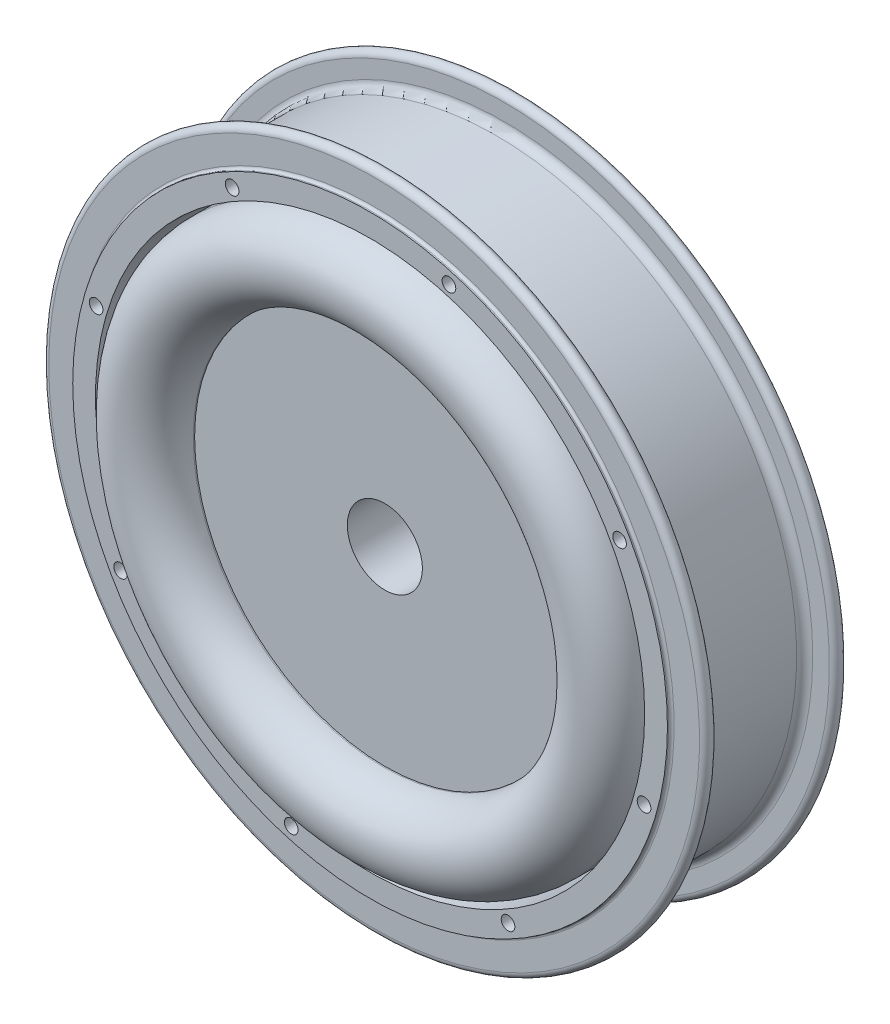
from build123d import *

# Parameters (mm, degrees)
SKETCH1_R           = 111
SKETCH1_R_2         = 102.5
BOSS_EXTRUDE1_DEPTH = 56
SKETCH2_R           = 2.544731427
CUT_EXTRUDE1_DEPTH  = 15
CIRPATTERN1_COUNT   = 8
SKETCH5_W           = 57
SKETCH5_H           = 35


with BuildPart() as part:
    # Sketch1 → Boss-Extrude1 (new body)
    with BuildSketch(Plane.XY):
        Circle(SKETCH1_R)
        Circle(SKETCH1_R_2, mode=Mode.SUBTRACT)
    extrude(amount=BOSS_EXTRUDE1_DEPTH)

    # Sketch2 → Cut-Extrude1 (cut)
    with BuildSketch(Plane.XY.offset(56)):
        with Locations((29.439514058, 102.263864137)):
            Circle(SKETCH2_R)
    cut_extrude1 = extrude(amount=-CUT_EXTRUDE1_DEPTH, mode=Mode.SUBTRACT)

    # CirPattern1: Cut-Extrude1 ×8 about axis
    cirpattern1_axis = Axis((0, 0, 0), (0, 0, 1))
    for i in range(1, CIRPATTERN1_COUNT):
        add(cut_extrude1.rotate(cirpattern1_axis, i * 360 / CIRPATTERN1_COUNT), mode=Mode.SUBTRACT)

    # Sketch6 → Revolve3 (revolve)
    with BuildSketch(Plane(origin=(0, 0, 0), x_dir=(0, 0, -1), z_dir=(1, 0, 0)), mode=Mode.PRIVATE) as revolve3_sk:
        with BuildLine():
            Line((-54.5, 112), (-54.5, 121.45))
            ThreePointArc((-54.5, 121.45), (-52.25, 123.7), (-50, 121.45))
            Line((-50, 121.45), (-50, 115.228396921))
            ThreePointArc((-50, 115.228396921), (-49.121320344, 113.107076578), (-47, 112.228396921))
            Line((-47, 112.228396921), (-9, 112.228396921))
            ThreePointArc((-9, 112.228396921), (-6.878679656, 113.107076578), (-6, 115.228396921))
            Line((-6, 115.228396921), (-6, 121.45))
            ThreePointArc((-6, 121.45), (-3.75, 123.7), (-1.5, 121.45))
            Line((-1.5, 121.45), (-1.5, 112))
            ThreePointArc((-1.5, 112), (-1.207106781, 111.292893219), (-0.5, 111))
            Line((-0.5, 111), (0, 111))
            Line((0, 111), (0, 110.708510282))
            Line((0, 110.708510282), (-56, 110.708510282))
            Line((-56, 110.708510282), (-56, 111))
            Line((-56, 111), (-55.5, 111))
            ThreePointArc((-55.5, 111), (-54.792893219, 111.292893219), (-54.5, 112))
        make_face()
    revolve(revolve3_sk.sketch.rotate(Axis((0, 0, 0), (0, 0, 1)), 90), axis=Axis((0, 0, 0), (0, 0, 1)))


with BuildPart() as body_2:
    # Sketch4 → Revolve1 (revolve)
    with BuildSketch(Plane(origin=(0, 0, 0), x_dir=(1, 0, 0), z_dir=(0, 1, 0)), mode=Mode.PRIVATE) as revolve1_sk:
        with BuildLine():
            Line((-71, -5), (-71, -51))
            ThreePointArc((-71, -51), (-86, -66), (-101, -51))
            Line((-101, -51), (-101, -5))
            ThreePointArc((-101, -5), (-86, 10), (-71, -5))
        make_face()
    revolve(revolve1_sk.sketch.rotate(Axis((0, 0, 28), (0, 0, -1)), 180), axis=Axis((0, 0, 28), (0, 0, -1)))

    # Sketch5 → Revolve2 (revolve)
    with BuildSketch(Plane(origin=(0, 0, 0), x_dir=(1, 0, 0), z_dir=(0, 1, 0)), mode=Mode.PRIVATE) as revolve2_sk:
        with Locations((-42.5, -33)):
            Rectangle(SKETCH5_W, SKETCH5_H)
    revolve(revolve2_sk.sketch.rotate(Axis((0, 0, 0), (0, 0, 1)), 180), axis=Axis((0, 0, 0), (0, 0, 1)))


solid = Compound([part.part, body_2.part])
